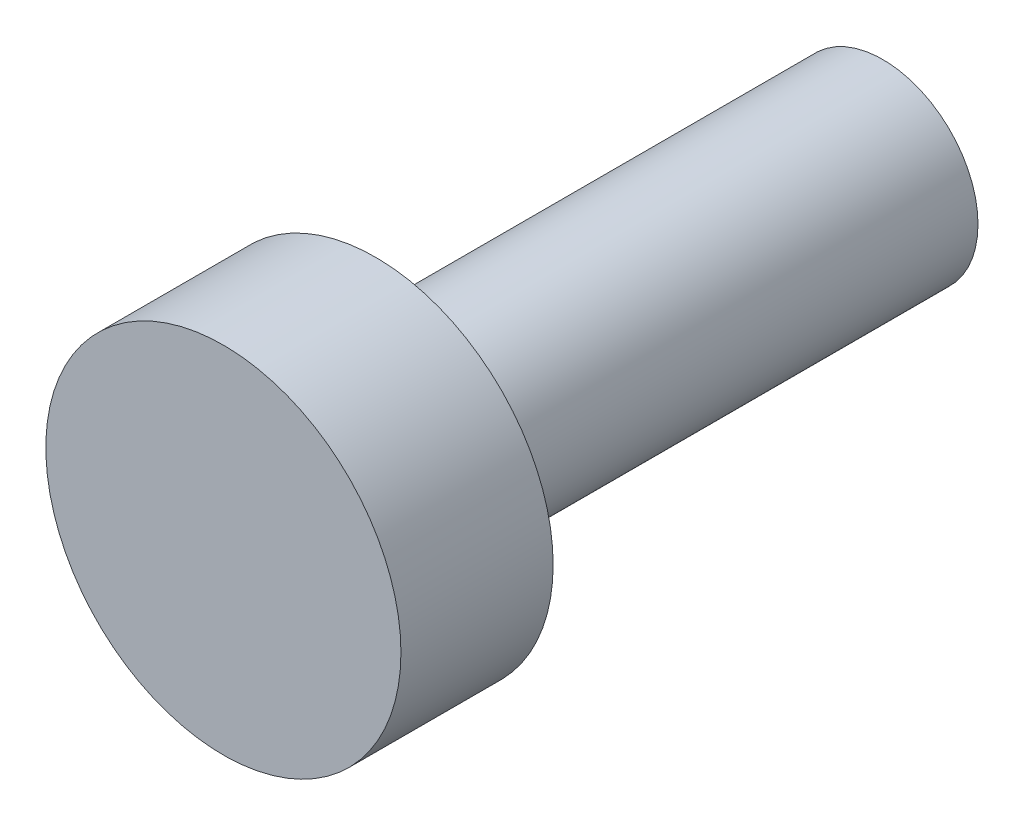
from build123d import *

# Parameters (mm, degrees)
ESQUISSE1_R        = 2.8
BOSS_EXTRU_1_DEPTH = 2.4
ESQUISSE2_R        = 1.5
BOSS_EXTRU_2_DEPTH = 8


with BuildPart() as part:
    # Esquisse1 → Boss.-Extru.1 (new body)
    with BuildSketch(Plane.XY):
        Circle(ESQUISSE1_R)
    extrude(amount=BOSS_EXTRU_1_DEPTH)

    # Esquisse2 → Boss.-Extru.2 (add)
    with BuildSketch(Plane(origin=(0, 0, 0), x_dir=(-1, 0, 0), z_dir=(0, 0, -1))):
        Circle(ESQUISSE2_R)
    extrude(amount=BOSS_EXTRU_2_DEPTH)


solid = part.part
